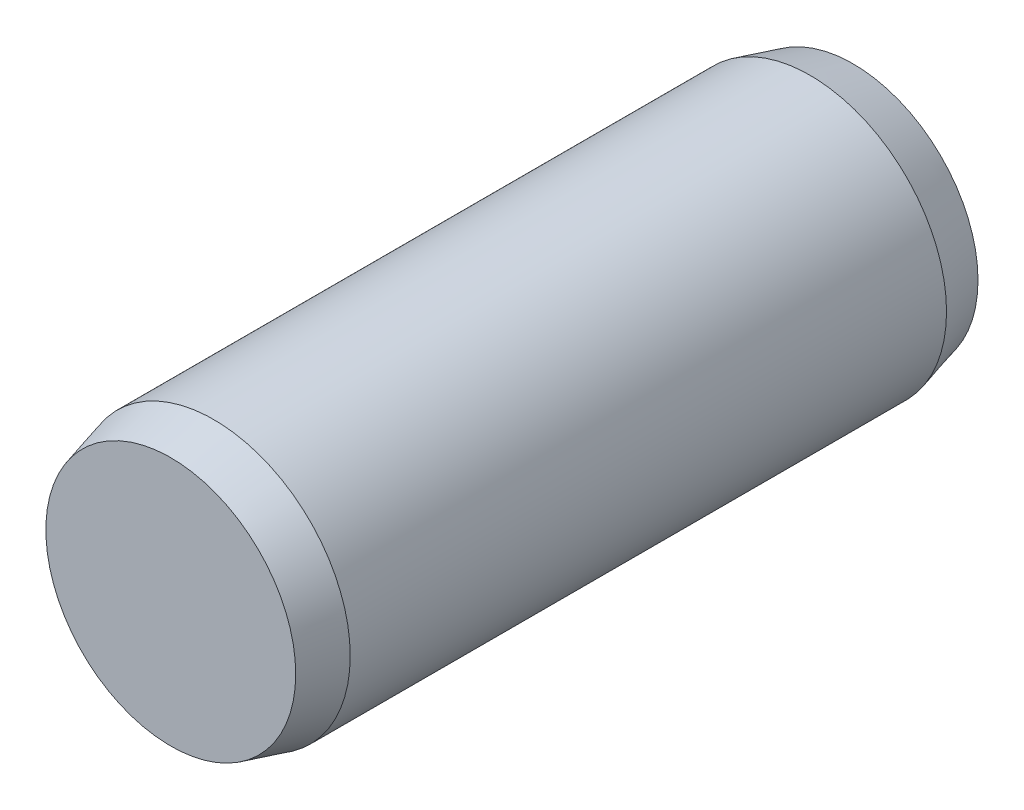
from build123d import *


with BuildPart() as part:
    # Sketch3 → Revolve1 (revolve)
    with BuildSketch(Plane(origin=(0, 0, 0), x_dir=(0, 0, -1), z_dir=(1, 0, 0)), mode=Mode.PRIVATE) as revolve1_sk:
        Polygon((-5, 0), (-5, 1.831192009), (-4.37, 2), (4.37, 2), (5, 1.831192009), (5, 0), align=None)
    revolve(revolve1_sk.sketch.rotate(Axis((0, 0, 5), (0, 0, -1)), 90), axis=Axis((0, 0, 5), (0, 0, -1)))


solid = part.part
